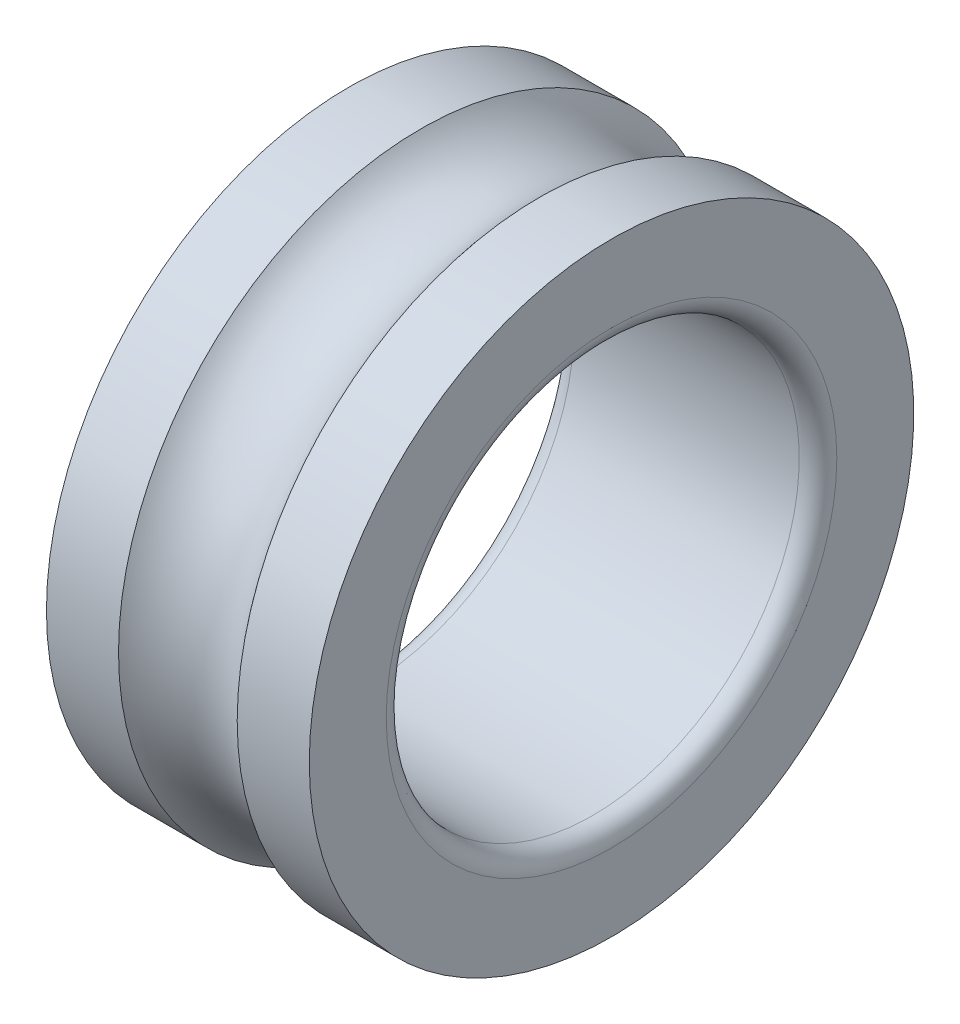
from build123d import *


with BuildPart() as part:
    # Sketch1 → Revolução1 (revolve)
    with BuildSketch(Plane.XY, mode=Mode.PRIVATE) as revolu_o1_sk:
        with BuildLine():
            Line((1, 11), (13, 11))
            ThreePointArc((13, 11), (13.707106781, 11.292893219), (14, 12))
            Line((14, 12), (14, 16.1))
            Line((14, 16.1), (10.161164501, 16.1))
            ThreePointArc((10.161164501, 16.1), (7, 14.531), (3.838835499, 16.1))
            Line((3.838835499, 16.1), (0, 16.1))
            Line((0, 16.1), (0, 12))
            ThreePointArc((0, 12), (0.292893219, 11.292893219), (1, 11))
        make_face()
    revolve(revolu_o1_sk.sketch.rotate(Axis((50, 0, 0), (-1, 0, 0)), 270), axis=Axis((50, 0, 0), (-1, 0, 0)))


solid = part.part
